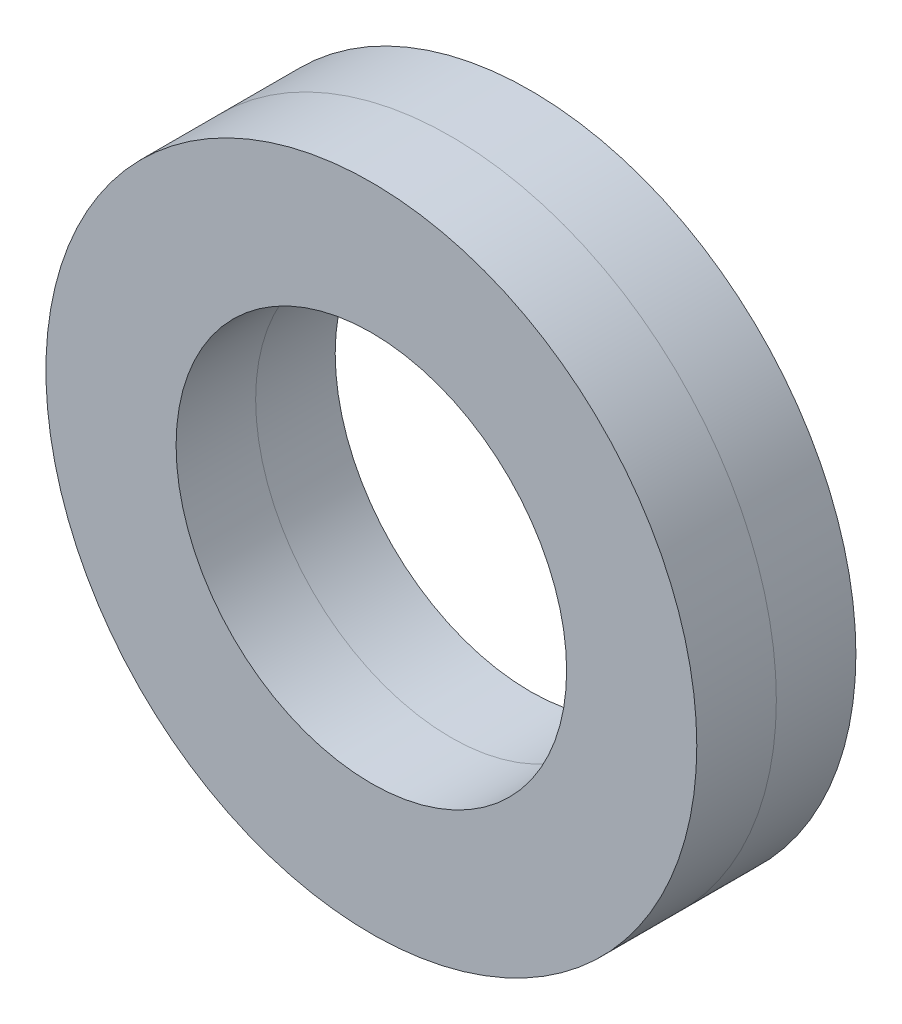
from build123d import *

# Parameters (mm, degrees)
SKETCH_8_W   = 1.1
SKETCH_8_H   = 1.8
SKETCH_8_8_W = 1.1
SKETCH_8_8_H = 1.8


with BuildPart() as part:
    # 草图8 → 旋转3 (revolve)
    with BuildSketch(Plane(origin=(0, 0, 0), x_dir=(0, 0, -1), z_dir=(1, 0, 0))):
        with Locations((-0.55, 3.6)):
            Rectangle(SKETCH_8_W, SKETCH_8_H)
    revolve(axis=Axis((0, 0, 0), (0, 0, -1)))


with BuildPart() as body_2:
    # 草图8<8> → 旋转4 (revolve)
    with BuildSketch(Plane(origin=(0, 0, 0), x_dir=(0, 0, -1), z_dir=(1, 0, 0))):
        with Locations((0.55, 3.6)):
            Rectangle(SKETCH_8_8_W, SKETCH_8_8_H)
    revolve(axis=Axis((0, 0, 0), (0, 0, -1)))


solid = Compound([part.part, body_2.part])
